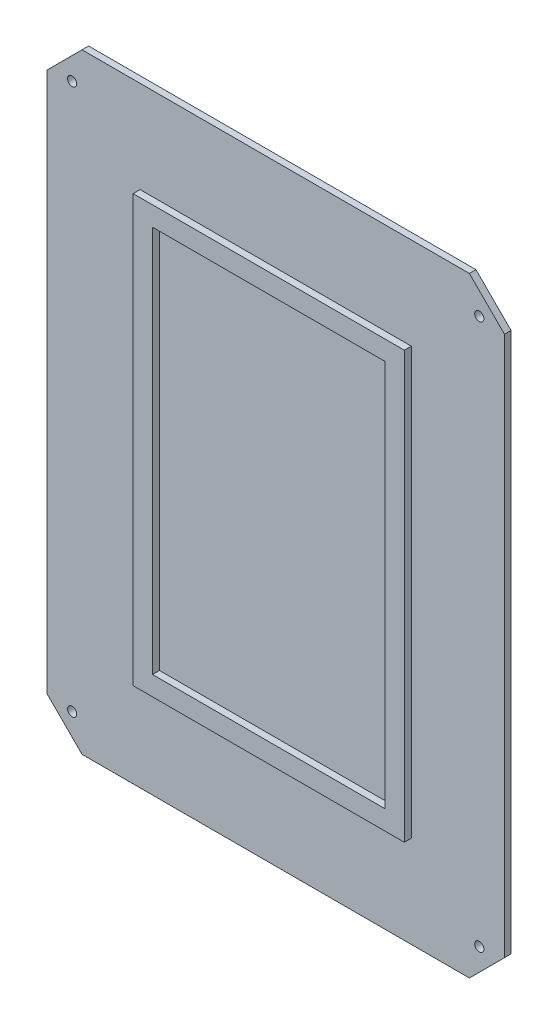
from build123d import *

# Parameters (mm, degrees)
BOSS_EXTRUDE1_DEPTH      = 2.159
BOSS_EXTRUDE1_DEPTH_BACK = 2.159
SKETCH6_W                = 177.8
SKETCH6_H                = 279.4
SKETCH6_W_2              = 152.4
SKETCH6_H_2              = 254
BOSS_EXTRUDE2_DEPTH      = 8.89
SKETCH7_R                = 3
CUT_EXTRUDE2_DEPTH       = 251.170207847


with BuildPart() as part:
    # Sketch3 → Boss-Extrude1 (new, two sides: drawn at the far end of the back side and taken through both)
    with BuildSketch(Plane.XY.offset(-BOSS_EXTRUDE1_DEPTH_BACK)):
        Polygon((-149.987, 177.025), (-126.987, 200.025), (126.987, 200.025), (149.987, 177.025), (149.987, -177.025), (126.987, -200.025), (-126.987, -200.025), (-149.987, -177.025), align=None)
    extrude(amount=BOSS_EXTRUDE1_DEPTH + BOSS_EXTRUDE1_DEPTH_BACK)

    # Sketch6 → Boss-Extrude2 (add)
    with BuildSketch(Plane(origin=(0, 0, -2.159), x_dir=(-1, 0, 0), z_dir=(0, 0, -1))):
        Rectangle(SKETCH6_W, SKETCH6_H)
        Rectangle(SKETCH6_W_2, SKETCH6_H_2, mode=Mode.SUBTRACT)
    extrude(amount=-BOSS_EXTRUDE2_DEPTH)

    # Sketch7 → Cut-Extrude2 (cut, through all)
    with BuildSketch(Plane(origin=(0, 0, -2.159), x_dir=(-1, 0, 0), z_dir=(0, 0, -1))):
        with Locations((133.477, 178.943)):
            Circle(SKETCH7_R)
        with Locations((-133.477, 178.943)):
            Circle(SKETCH7_R)
        with Locations((-133.477, -178.943)):
            Circle(SKETCH7_R)
        with Locations((133.477, -178.943)):
            Circle(SKETCH7_R)
    extrude(amount=-CUT_EXTRUDE2_DEPTH, mode=Mode.SUBTRACT)


solid = part.part
